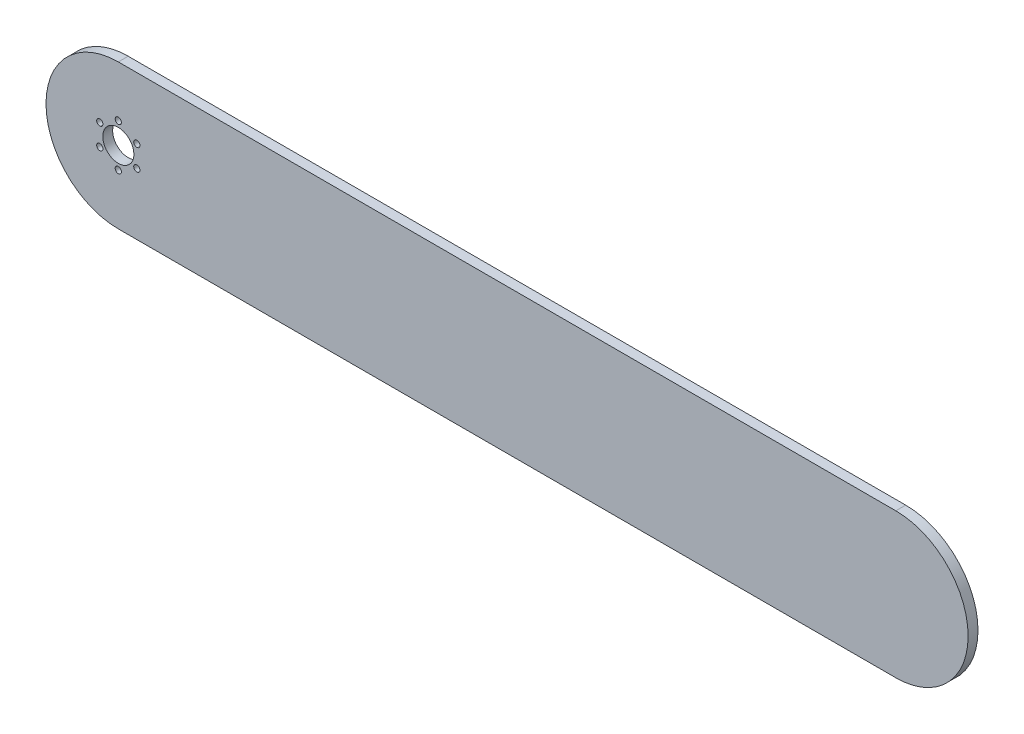
from build123d import *

# Parameters (mm, degrees)
SKETCH2_R           = 10
SKETCH2_R_2         = 2
BOSS_EXTRUDE1_DEPTH = 6.35


with BuildPart() as part:
    # Sketch2 → Boss-Extrude1 (new body)
    with BuildSketch(Plane.XY):
        with BuildLine():
            Line((0, 46.5), (500, 46.5))
            ThreePointArc((500, 46.5), (546.5, 0), (500, -46.5))
            Line((500, -46.5), (0, -46.5))
            ThreePointArc((0, -46.5), (-46.5, 0), (0, 46.5))
        make_face()
        Circle(SKETCH2_R, mode=Mode.SUBTRACT)
        with Locations((0, 13.75)):
            Circle(SKETCH2_R_2, mode=Mode.SUBTRACT)
        with Locations((11.907849302, 6.875)):
            Circle(SKETCH2_R_2, mode=Mode.SUBTRACT)
        with Locations((11.907849302, -6.875)):
            Circle(SKETCH2_R_2, mode=Mode.SUBTRACT)
        with Locations((0, -13.75)):
            Circle(SKETCH2_R_2, mode=Mode.SUBTRACT)
        with Locations((-11.907849302, -6.875)):
            Circle(SKETCH2_R_2, mode=Mode.SUBTRACT)
        with Locations((-11.907849302, 6.875)):
            Circle(SKETCH2_R_2, mode=Mode.SUBTRACT)
    extrude(amount=BOSS_EXTRUDE1_DEPTH)


solid = part.part
